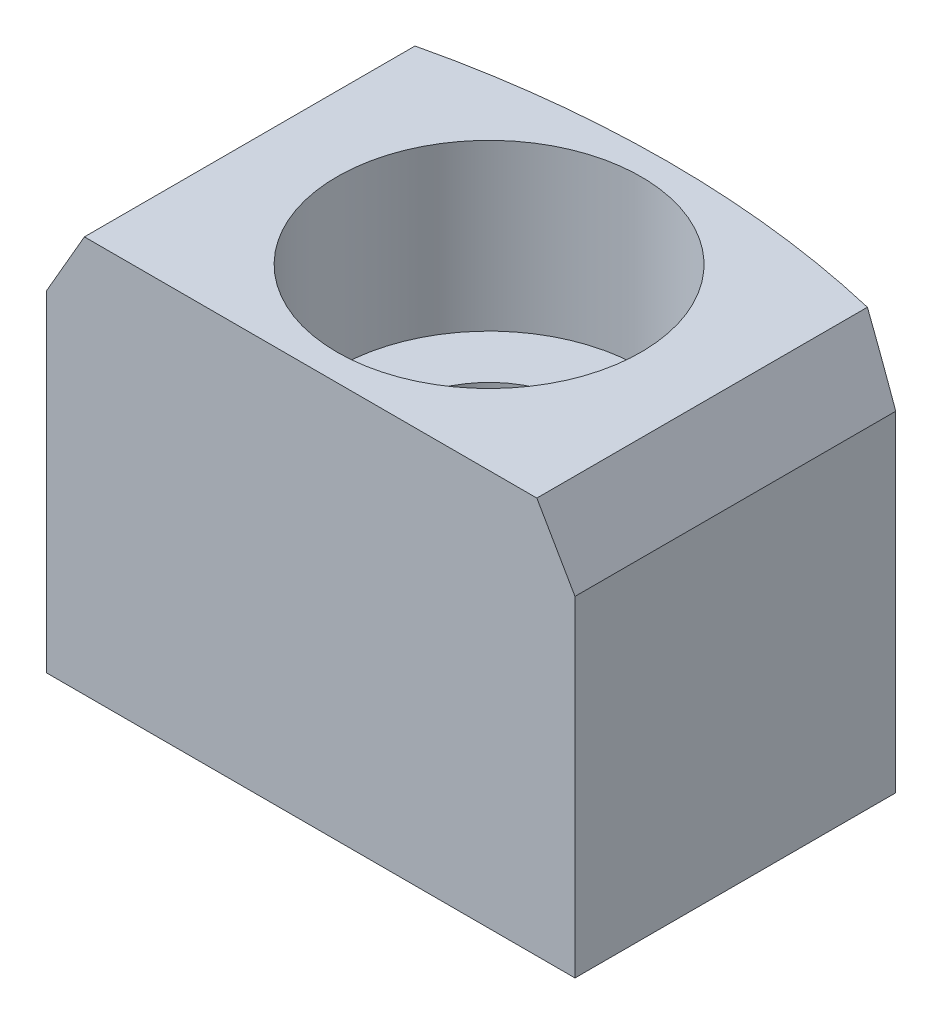
from build123d import *
from OCP.BRepFilletAPI import BRepFilletAPI_MakeChamfer

# Parameters (mm, degrees)
SKETCH1_W                = 8
SKETCH1_H                = 5.7
EXTRUDED_BOSS_BASE_DEPTH = 3
LEGACY_HOLE_D            = 2.7
LEGACY_HOLE_CBORE_D      = 4.6
LEGACY_HOLE_CBORE_DEPTH  = 2.5
FILLET_2_SIZE            = 1
FILLET_2_SIZE2           = 0.577350269
SKETCH4_R                = 15.717506164
SKETCH4_R_2              = 14.9
EXTRUDED_CUT_DEPTH       = 8.810249676


with BuildPart() as part:
    # Sketch1 → Extruded Boss/Base (new, symmetric)
    with BuildSketch(Plane(origin=(0, 0, 0), x_dir=(1, 0, 0), z_dir=(0, 1, 0))):
        with Locations((0, 0.15)):
            Rectangle(SKETCH1_W, SKETCH1_H)
    extrude(amount=EXTRUDED_BOSS_BASE_DEPTH, both=True)

    # Legacy Hole (through all)
    with Locations(Plane(origin=(0, 3, 0), x_dir=(-1, 0, 0), z_dir=(0, 1, 0))):
        with Locations((0, 0)):
            CounterBoreHole(LEGACY_HOLE_D / 2, LEGACY_HOLE_CBORE_D / 2, LEGACY_HOLE_CBORE_DEPTH)

    # Fillet 2: one chamfer whose edges measure the first distance from different faces: ONE call of the kernel's chamfer builder (chamfer() names one face for all edges)
    fillet_2_edges_1 = [part.edges().sort_by_distance(p)[0] for p in [
        (4, 3, -0.15),
    ]]
    fillet_2_side_1 = [part.faces().sort_by_distance(p)[0] for p in [
        (4, 0, -0.15),
    ]]
    fillet_2_edges_2 = [part.edges().sort_by_distance(p)[0] for p in [
        (-4, 3, -0.15),
    ]]
    fillet_2_side_2 = [part.faces().sort_by_distance(p)[0] for p in [
        (-4, 0, -0.15),
    ]]
    fillet_2 = BRepFilletAPI_MakeChamfer(part.part.solid().wrapped)
    for e in fillet_2_edges_1:
        fillet_2.Add(FILLET_2_SIZE, FILLET_2_SIZE2, e.wrapped, fillet_2_side_1[0].wrapped)  # the first distance lies on this face
    for e in fillet_2_edges_2:
        fillet_2.Add(FILLET_2_SIZE, FILLET_2_SIZE2, e.wrapped, fillet_2_side_2[0].wrapped)  # the first distance lies on this face
    add(Compound.cast(fillet_2.Shape()), mode=Mode.REPLACE)

    # Sketch4 → Extruded Cut (cut, through all)
    with BuildSketch(Plane(origin=(0, 3, 0), x_dir=(1, 0, 0), z_dir=(0, 1, 0))):
        with Locations((0, -12.2)):
            Circle(SKETCH4_R)
        with Locations((0, -12.2)):
            Circle(SKETCH4_R_2, mode=Mode.SUBTRACT)
    extrude(amount=-EXTRUDED_CUT_DEPTH, mode=Mode.SUBTRACT)


solid = part.part
